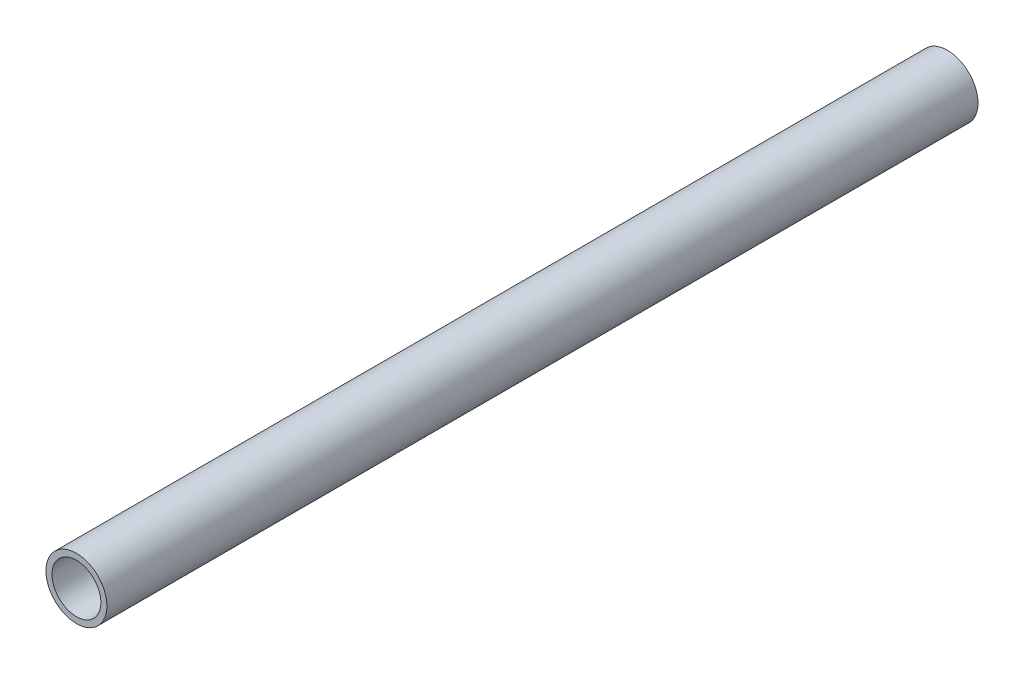
from build123d import *

# Parameters (mm, degrees)
BOSS_EXTRUDE1_DEPTH      = 152.4
BOSS_EXTRUDE1_DEPTH_BACK = 152.4
SKETCH3_R                = 10.668
SKETCH3_R_2              = 8.5598


with BuildPart() as part:
    # Sketch3 → Boss-Extrude1 (new, two sides: drawn at the far end of the back side and taken through both)
    with BuildSketch(Plane.XY.offset(-BOSS_EXTRUDE1_DEPTH_BACK)):
        Circle(SKETCH3_R)
        Circle(SKETCH3_R_2, mode=Mode.SUBTRACT)
    extrude(amount=BOSS_EXTRUDE1_DEPTH + BOSS_EXTRUDE1_DEPTH_BACK)


solid = part.part
